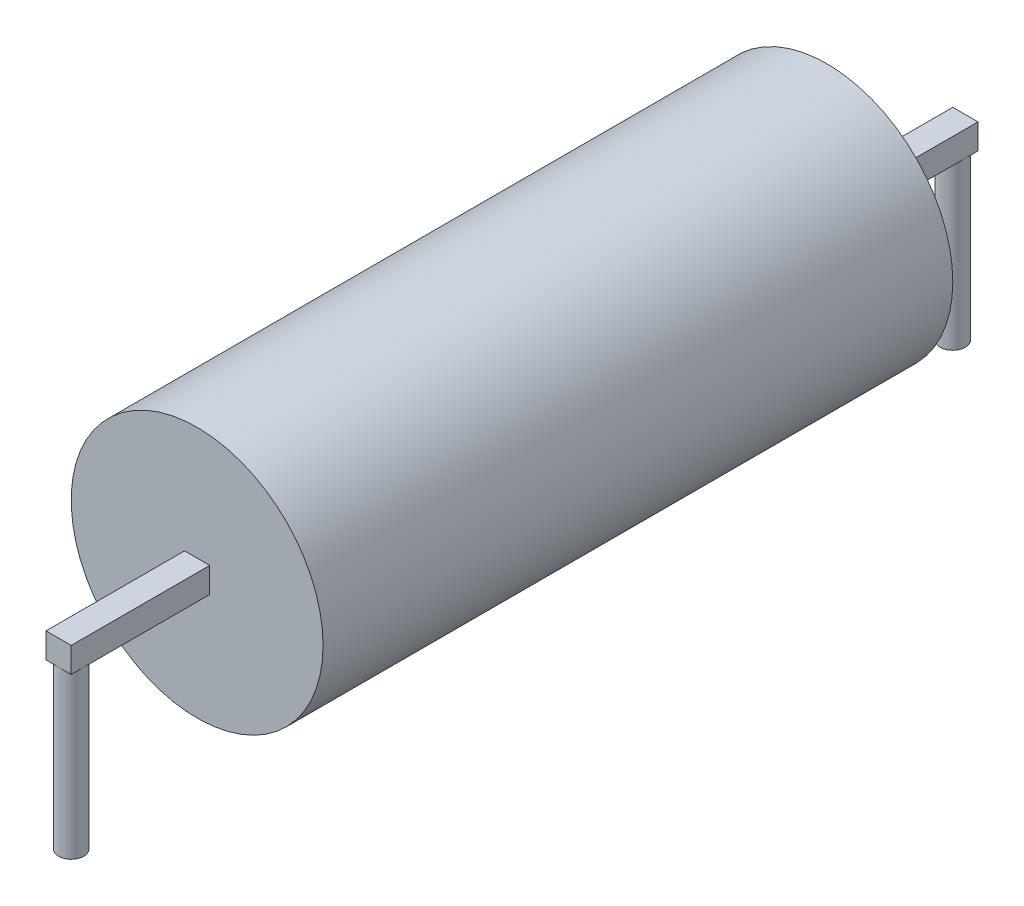
from build123d import *

# Parameters (mm, degrees)
SKETCH_1_R           = 5
EXTRUDE_1_DEPTH      = 25
EXTRUDE_2_DEPTH      = 5.5
EXTRUDE_2_DEPTH_BACK = 30.5
SKETCH_2_W           = 1
SKETCH_2_H           = 1
SKETCH_3_R           = 0.5
EXTRUDE_3_DEPTH      = 6.5


with BuildPart() as part:
    # Эскиз1 → Вытянуть1 (new body)
    with BuildSketch(Plane.XY):
        Circle(SKETCH_1_R)
    extrude(amount=EXTRUDE_1_DEPTH)

    # Эскиз2 → Вытянуть2 (add, two sides: drawn at the far end of the back side and taken through both)
    with BuildSketch(Plane.XY.offset(25).offset(-EXTRUDE_2_DEPTH_BACK)):
        Rectangle(SKETCH_2_W, SKETCH_2_H)
    extrude(amount=EXTRUDE_2_DEPTH + EXTRUDE_2_DEPTH_BACK)

    # Эскиз3 → Вытянуть3 (add)
    with BuildSketch(Plane.XZ.offset(0.5)):
        with Locations((0, 30)):
            Circle(SKETCH_3_R)
        with Locations((0, -5)):
            Circle(SKETCH_3_R)
    extrude(amount=EXTRUDE_3_DEPTH)


solid = part.part
